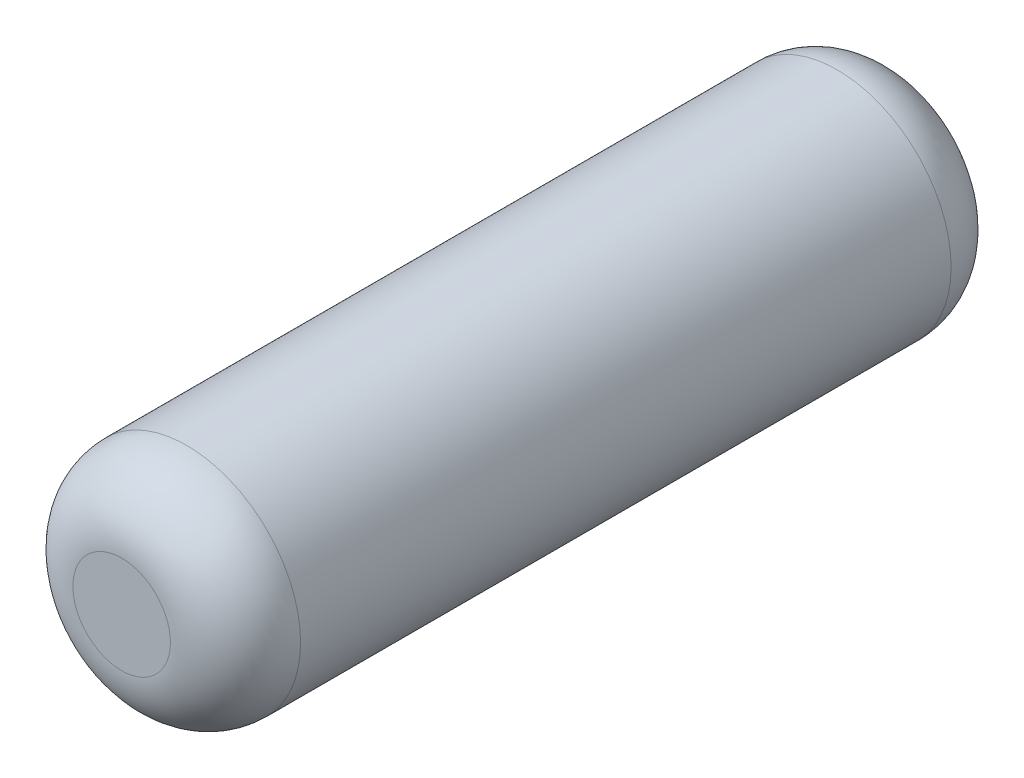
from build123d import *

# Parameters (mm, degrees)
SKETCH2_R           = 44.45
BOSS_EXTRUDE1_DEPTH = 304.8
FILLET2_R           = 25.4


with BuildPart() as part:
    # Sketch2 → Boss-Extrude1 (new body)
    with BuildSketch(Plane.XY):
        with Locations(Location((0, 0, 0), (0, 0, 180))):
            Circle(SKETCH2_R)
    extrude(amount=BOSS_EXTRUDE1_DEPTH)

    # Fillet2
    fillet2_edges = [part.edges().sort_by_distance(p)[0] for p in [
        (44.45, 0, 0),
        (44.45, 0, 304.8),
    ]]
    fillet(fillet2_edges, radius=FILLET2_R)


solid = part.part
